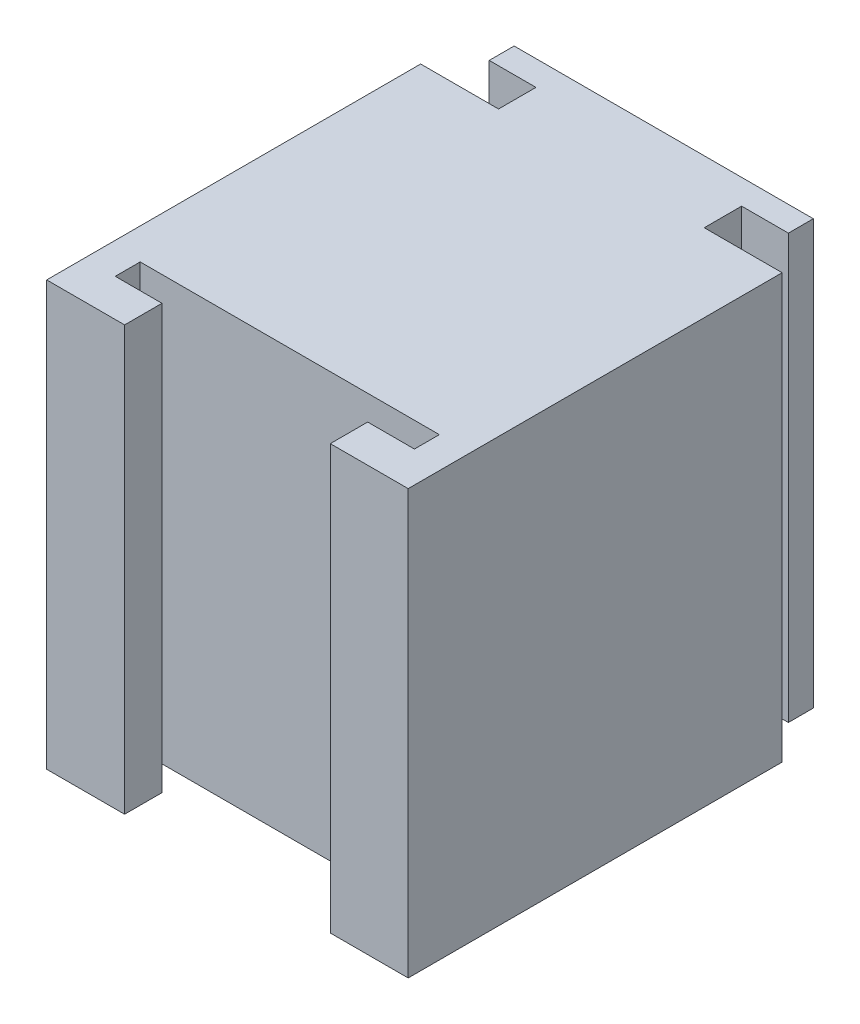
from build123d import *

# Parameters (mm, degrees)
BOSS_EXTRUDE1_DEPTH = 17


with BuildPart() as part:
    # Sketch1 → Boss-Extrude1 (new, symmetric)
    with BuildSketch(Plane(origin=(0, 0, 0), x_dir=(1, 0, 0), z_dir=(0, 1, 0))):
        Polygon((-12, 18), (-8.25, 18), (-8.25, 15), (-14.5, 15), (-14.5, -15), (-8.25, -15), (-8.25, -12), (-12, -12), (-12, -10), (12, -10), (12, -12), (8.25, -12), (8.25, -15), (14.5, -15), (14.5, 15), (8.25, 15), (8.25, 18), (12, 18), (12, 20), (-12, 20), align=None)
    extrude(amount=BOSS_EXTRUDE1_DEPTH, both=True)


solid = part.part
